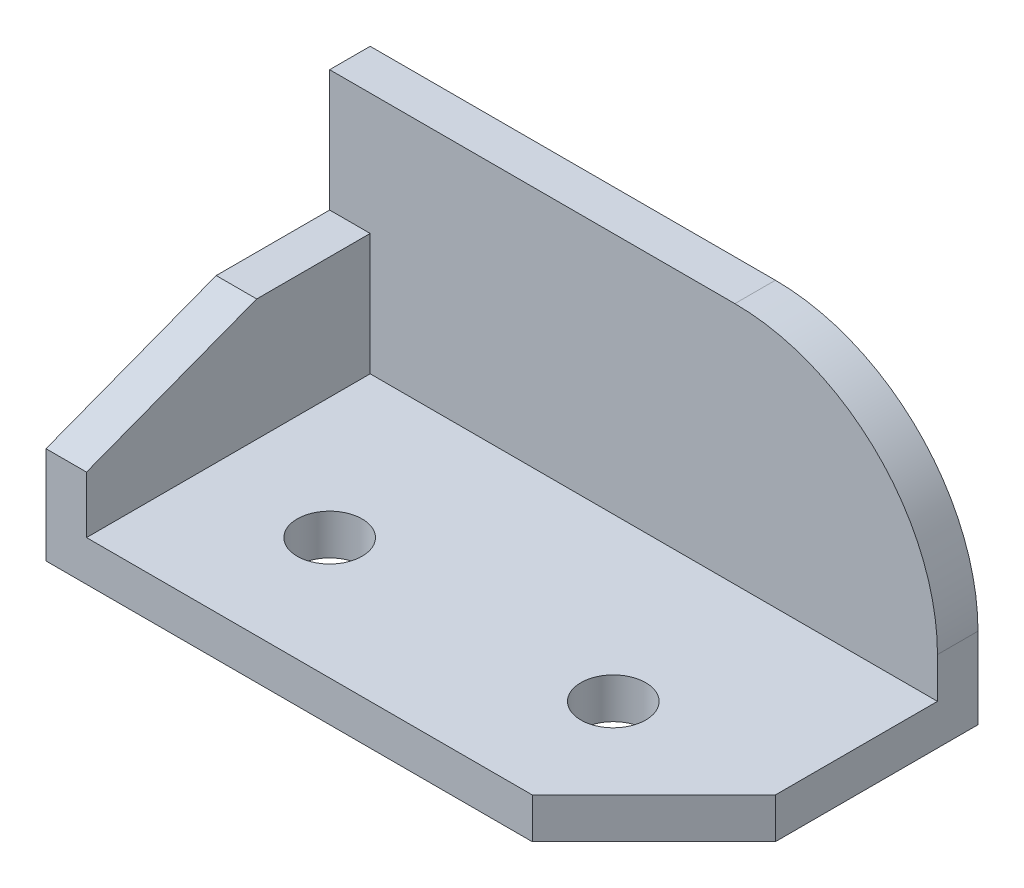
from build123d import *

# Parameters (mm, degrees)
BOSS_EXTRUDE1_DEPTH = 75
BOSS_EXTRUDE2_DEPTH = 5
HOLE1_D             = 8
CHAMFER1_SIZE       = 15
FILLET1_R           = 25


with BuildPart() as part:
    # Sketch1 → Boss-Extrude1 (new body)
    with BuildSketch(Plane(origin=(0, 0, 0), x_dir=(0, 0, -1), z_dir=(1, 0, 0))):
        Polygon((-40, 0), (0, 0), (0, 35), (-5, 35), (-5, 20), (-5, 5), (-40, 5), align=None)
    extrude(amount=BOSS_EXTRUDE1_DEPTH)

    # Sketch1<3> → Boss-Extrude2 (add)
    with BuildSketch(Plane(origin=(0, 0, 0), x_dir=(0, 0, -1), z_dir=(1, 0, 0))):
        Polygon((-40, 12), (-40, 5), (-5, 5), (-5, 20), (-19, 20), align=None)
    extrude(amount=BOSS_EXTRUDE2_DEPTH)

    # Hole1 (through all)
    with Locations(Plane(origin=(0, 5, 0), x_dir=(1, 0, 0), z_dir=(0, 1, 0))):
        with Locations((20, -25), (55, -25)):
            Hole(HOLE1_D / 2)

    # Chamfer1
    chamfer1_edges = [part.edges().sort_by_distance(p)[0] for p in [
        (75, 2.5, 40),
    ]]
    chamfer(chamfer1_edges, length=CHAMFER1_SIZE)

    # Fillet1
    fillet1_edges = [part.edges().sort_by_distance(p)[0] for p in [
        (75, 35, 2.5),
    ]]
    fillet(fillet1_edges, radius=FILLET1_R)


solid = part.part
